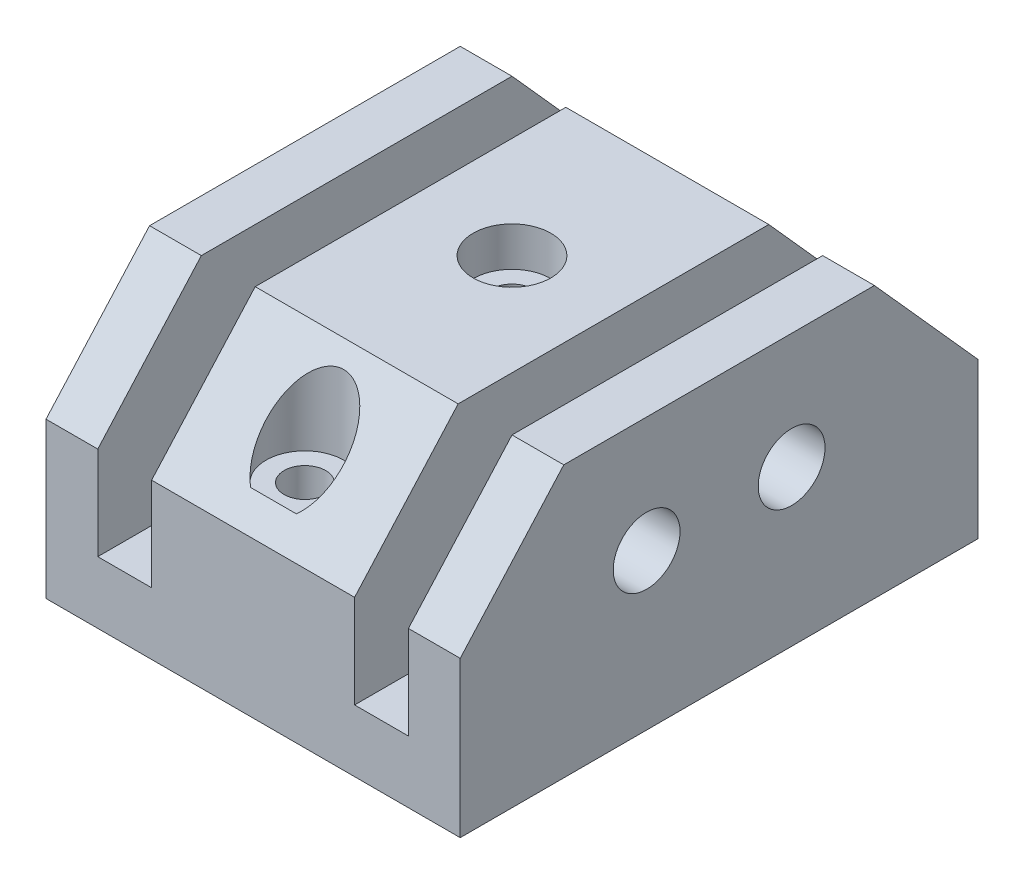
from build123d import *

# Parameters (mm, degrees)
SKETCH1_W                                       = 63.5
SKETCH1_H                                       = 6.35
BOSS_EXTRUDE1_DEPTH                             = 50.8
BOSS_EXTRUDE2_DEPTH                             = 50.8
SKETCH10_W                                      = 6.604
SKETCH10_H                                      = 25.629031657
CUT_EXTRUDE1_DEPTH                              = 88.854357354
LPATTERN3_COUNT                                 = 2
LPATTERN3_PITCH                                 = 31.496
SKETCH11_R                                      = 4.09575
CUT_EXTRUDE2_DEPTH                              = 88.854357354
CBORE_FOR_10_SOCKET_HEAD_CAP_SCREW1_D           = 5.1054
CBORE_FOR_10_SOCKET_HEAD_CAP_SCREW1_CBORE_D     = 9.525
CBORE_FOR_10_SOCKET_HEAD_CAP_SCREW1_CBORE_DEPTH = 4.826
CBORE_FOR_10_SOCKET_HEAD_CAP_SCREW3_D           = 5.1054
CBORE_FOR_10_SOCKET_HEAD_CAP_SCREW3_CBORE_D     = 9.525
CBORE_FOR_10_SOCKET_HEAD_CAP_SCREW3_CBORE_DEPTH = 11.176


with BuildPart() as part:
    # Sketch1 → Boss-Extrude1 (new body)
    with BuildSketch(Plane(origin=(0, 0, 0), x_dir=(0, 0, -1), z_dir=(1, 0, 0))):
        with Locations((31.75, 3.175)):
            Rectangle(SKETCH1_W, SKETCH1_H)
    extrude(amount=-BOSS_EXTRUDE1_DEPTH)

    # Sketch2 → Boss-Extrude2 (add)
    with BuildSketch(Plane(origin=(0, 0, 0), x_dir=(0, 0, -1), z_dir=(1, 0, 0))):
        Polygon((0, 6.35), (0, 19.05), (12.7, 33.249031657), (50.8, 33.249031657), (63.5, 19.05), (63.5, 6.35), align=None)
    extrude(amount=-BOSS_EXTRUDE2_DEPTH)

    # Sketch10 → Cut-Extrude1 (cut, through all)
    with BuildSketch(Plane(origin=(0, 0, -63.5), x_dir=(-1, 0, 0), z_dir=(0, 0, -1))):
        with Locations((9.652, 20.434515829)):
            Rectangle(SKETCH10_W, SKETCH10_H)
    cut_extrude1 = extrude(amount=-CUT_EXTRUDE1_DEPTH, mode=Mode.SUBTRACT)

    # LPattern3: Cut-Extrude1 ×2
    with Locations(*[(-i * LPATTERN3_PITCH, 0, 0) for i in range(1, LPATTERN3_COUNT)]):
        add(cut_extrude1, mode=Mode.SUBTRACT)

    # Sketch11 → Cut-Extrude2 (cut, through all)
    with BuildSketch(Plane(origin=(0, 0, 0), x_dir=(0, 0, -1), z_dir=(1, 0, 0))):
        with Locations((22.86, 19.05)):
            Circle(SKETCH11_R)
        with Locations((40.64, 19.05)):
            Circle(SKETCH11_R)
    extrude(amount=-CUT_EXTRUDE2_DEPTH, mode=Mode.SUBTRACT)

    # CBORE for #10 Socket Head Cap Screw1 (through all)
    with Locations(Plane(origin=(0, 33.249031657, 0), x_dir=(1, 0, 0), z_dir=(0, 1, 0))):
        with Locations((-25.4, 31.75)):
            CounterBoreHole(CBORE_FOR_10_SOCKET_HEAD_CAP_SCREW1_D / 2, CBORE_FOR_10_SOCKET_HEAD_CAP_SCREW1_CBORE_D / 2, CBORE_FOR_10_SOCKET_HEAD_CAP_SCREW1_CBORE_DEPTH)

    # CBORE for #10 Socket Head Cap Screw3 (through all)
    with Locations(Plane(origin=(0, 33.02, 0), x_dir=(-1, 0, 0), z_dir=(0, 1, 0))):
        with Locations((25.4, -6.35), (25.4, -57.15)):
            CounterBoreHole(CBORE_FOR_10_SOCKET_HEAD_CAP_SCREW3_D / 2, CBORE_FOR_10_SOCKET_HEAD_CAP_SCREW3_CBORE_D / 2, CBORE_FOR_10_SOCKET_HEAD_CAP_SCREW3_CBORE_DEPTH)


solid = part.part
